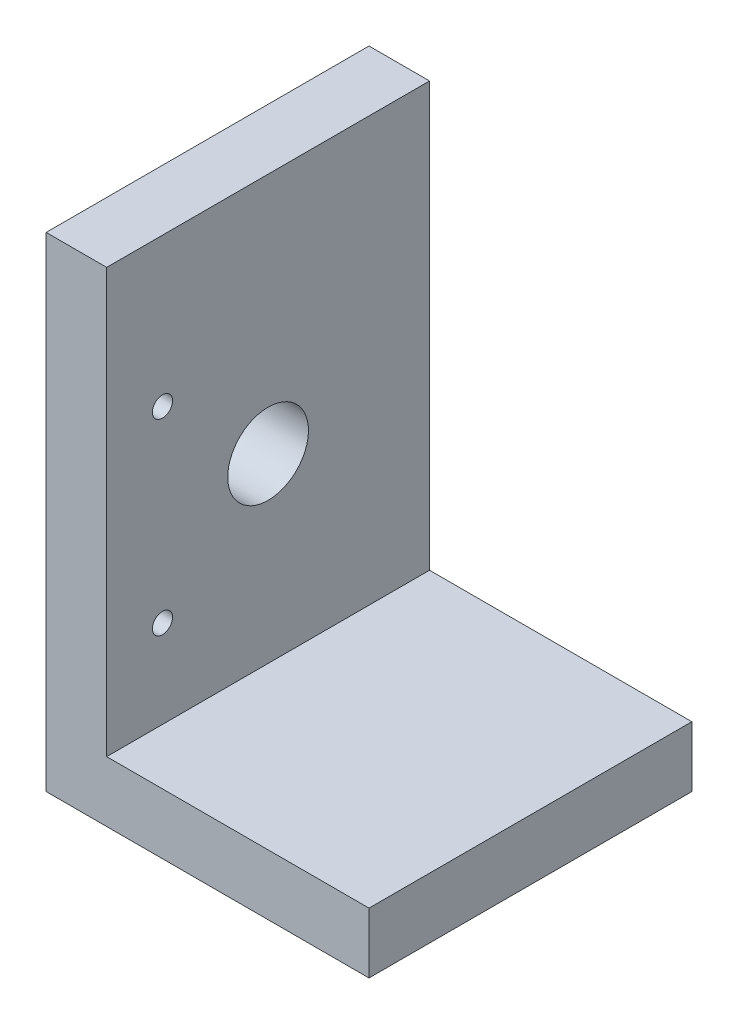
from build123d import *

# Parameters (mm, degrees)
BOSS_EXTRUDE1_DEPTH = 25.4
SKETCH3_R           = 6.35
CUT_EXTRUDE1_DEPTH  = 91.306287849
SKETCH4_R           = 1.5875
CUT_EXTRUDE2_DEPTH  = 91.306287849


with BuildPart() as part:
    # Sketch2 → Boss-Extrude1 (new, symmetric)
    with BuildSketch(Plane.XY):
        Polygon((0, 0), (0, 76.2), (9.525, 76.2), (9.525, 9.525), (50.8, 9.525), (50.8, 0), align=None)
    extrude(amount=BOSS_EXTRUDE1_DEPTH, both=True)

    # Sketch3 → Cut-Extrude1 (cut, through all)
    with BuildSketch(Plane(origin=(9.525, 0, 0), x_dir=(0, 0, -1), z_dir=(1, 0, 0))):
        with Locations(Location((0, 38.1, 0), (0, 0, 90))):
            Circle(SKETCH3_R)
    extrude(amount=-CUT_EXTRUDE1_DEPTH, mode=Mode.SUBTRACT)

    # Sketch4 → Cut-Extrude2 (cut, through all)
    with BuildSketch(Plane(origin=(9.525, 0, 0), x_dir=(0, 0, -1), z_dir=(1, 0, 0))):
        with Locations(Location((-16.621505447, 52.853853113, 0), (0, 0, 90))):
            Circle(SKETCH4_R)
        with Locations(Location((-16.621505447, 23.346146887, 0), (0, 0, 90))):
            Circle(SKETCH4_R)
    extrude(amount=-CUT_EXTRUDE2_DEPTH, mode=Mode.SUBTRACT)


solid = part.part
